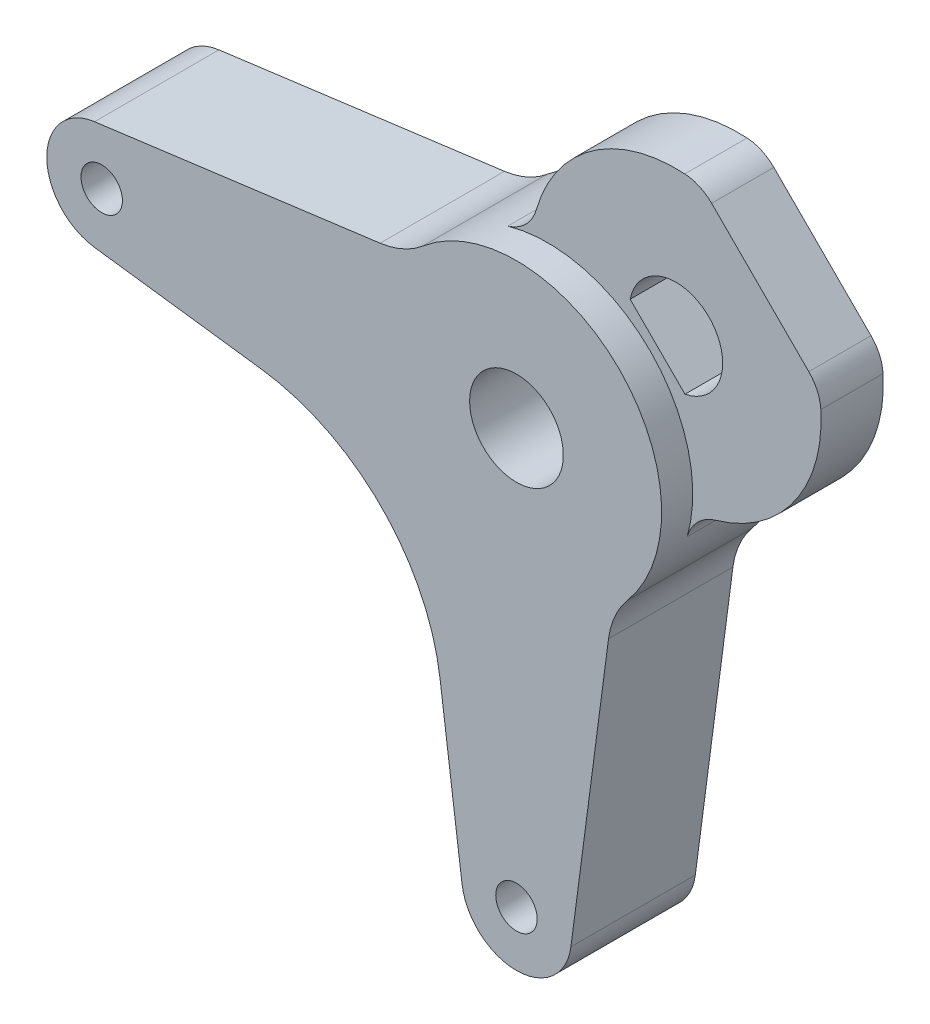
from build123d import *

# Parameters (mm, degrees)
SKETCH1_R           = 6.35
SKETCH1_R_2         = 14.351
BOSS_EXTRUDE2_DEPTH = 19.05
BOSS_EXTRUDE3_DEPTH = 9.525
FILLET1_R           = 12.7


with BuildPart() as part:
    # Sketch1 → Boss-Extrude2 (new, symmetric)
    with BuildSketch(Plane.XY):
        with BuildLine():
            ThreePointArc((33.959932382, -28.67970524), (30.132939696, -34.801505964), (28.182908549, -41.752742952))
            Line((28.182908549, -41.752742952), (16.670947055, -129.194771817))
            ThreePointArc((16.670947055, -129.194771817), (0, -143.8148), (-16.670947055, -129.194771817))
            Line((-16.670947055, -129.194771817), (-23.40165253, -78.069988022))
            ThreePointArc((-23.40165253, -78.069988022), (-41.457120622, -41.457120622), (-78.069988022, -23.40165253))
            Line((-78.069988022, -23.40165253), (-129.194771817, -16.670947055))
            ThreePointArc((-129.194771817, -16.670947055), (-143.8148, 0), (-129.194771817, 16.670947055))
            Line((-129.194771817, 16.670947055), (-41.752742952, 28.182908549))
            ThreePointArc((-41.752742952, 28.182908549), (-34.801505964, 30.132939696), (-28.67970524, 33.959932382))
            ThreePointArc((-28.67970524, 33.959932382), (31.430896424, 31.430896424), (33.959932382, -28.67970524))
        make_face()
        with Locations(Location((0, -127, 0), (0, 0, 180))):
            Circle(SKETCH1_R, mode=Mode.SUBTRACT)
        with Locations(Location((-127, 0, 0), (0, 0, 180))):
            Circle(SKETCH1_R, mode=Mode.SUBTRACT)
        with Locations(Location((0, 0, 0), (0, 0, 180))):
            Circle(SKETCH1_R_2, mode=Mode.SUBTRACT)
    extrude(amount=BOSS_EXTRUDE2_DEPTH, both=True)

    # Sketch3 → Boss-Extrude3 (add, symmetric)
    with BuildSketch(Plane.XY):
        with BuildLine():
            Line((47.146344636, 83.06736912), (83.06736912, 47.146344636))
            ThreePointArc((83.06736912, 47.146344636), (74.914696381, 12.698674104), (44.182474556, -4.869439613))
            ThreePointArc((44.182474556, -4.869439613), (31.430896424, 31.430896424), (-4.869439613, 44.182474556))
            ThreePointArc((-4.869439613, 44.182474556), (12.698674104, 74.914696381), (47.146344636, 83.06736912))
        make_face()
        with BuildLine():
            Line((25.281244781, 42.070676127), (42.070676127, 25.281244781))
            ThreePointArc((42.070676127, 25.281244781), (49.424803335, 49.424803335), (25.281244781, 42.070676127))
        make_face(mode=Mode.SUBTRACT)
    extrude(amount=BOSS_EXTRUDE3_DEPTH, both=True)

    # Fillet1
    fillet1_edges = [part.edges().sort_by_distance(p)[0] for p in [
        (47.146344636, 83.06736912, 0),
        (-4.869439613, 44.182474556, 0),
        (44.182474556, -4.869439613, 0),
        (83.06736912, 47.146344636, 0),
    ]]
    fillet(fillet1_edges, radius=FILLET1_R)


solid = part.part
